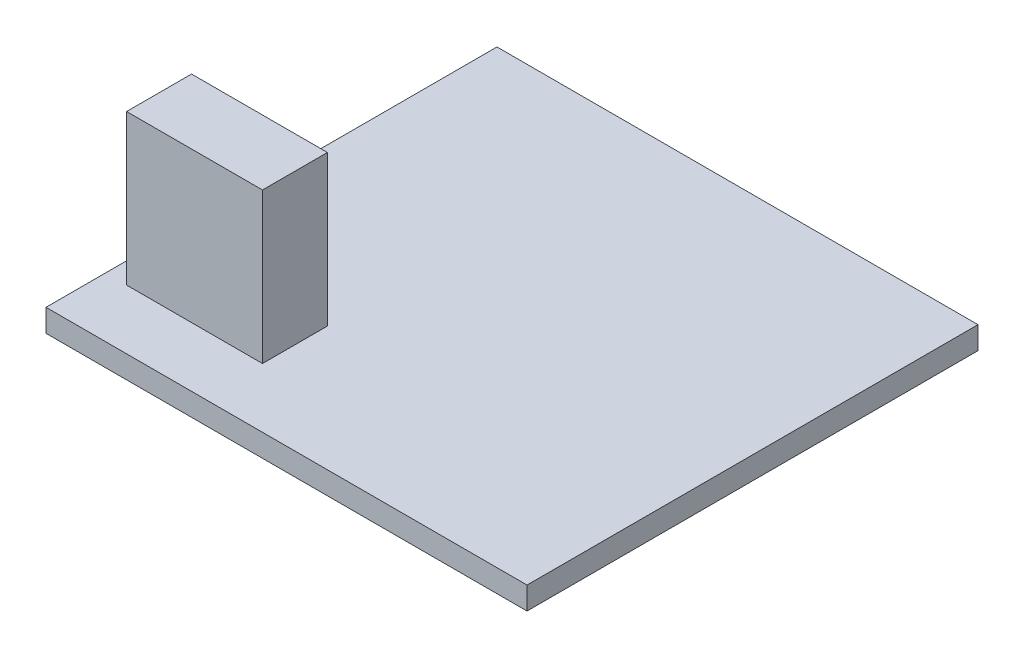
from build123d import *

# Parameters (mm, degrees)
SKETCH_1_W      = 32
SKETCH_1_H      = 30
EXTRUDE_1_DEPTH = 1.5
SKETCH_2_W      = 9.039344648
SKETCH_2_H      = 4.319686823
EXTRUDE_2_DEPTH = 10


with BuildPart() as part:
    # 草图1 → 凸台-拉伸1 (new body)
    with BuildSketch(Plane(origin=(0, 0, 0), x_dir=(1, 0, 0), z_dir=(0, 1, 0))):
        Rectangle(SKETCH_1_W, SKETCH_1_H)
    extrude(amount=EXTRUDE_1_DEPTH)

    # 草图2 → 凸台-拉伸2 (add)
    with BuildSketch(Plane(origin=(0, 1.5, 0), x_dir=(1, 0, 0), z_dir=(0, 1, 0))):
        with Locations((-10.079269253, -8.879356247)):
            Rectangle(SKETCH_2_W, SKETCH_2_H)
    extrude(amount=EXTRUDE_2_DEPTH)


solid = part.part
